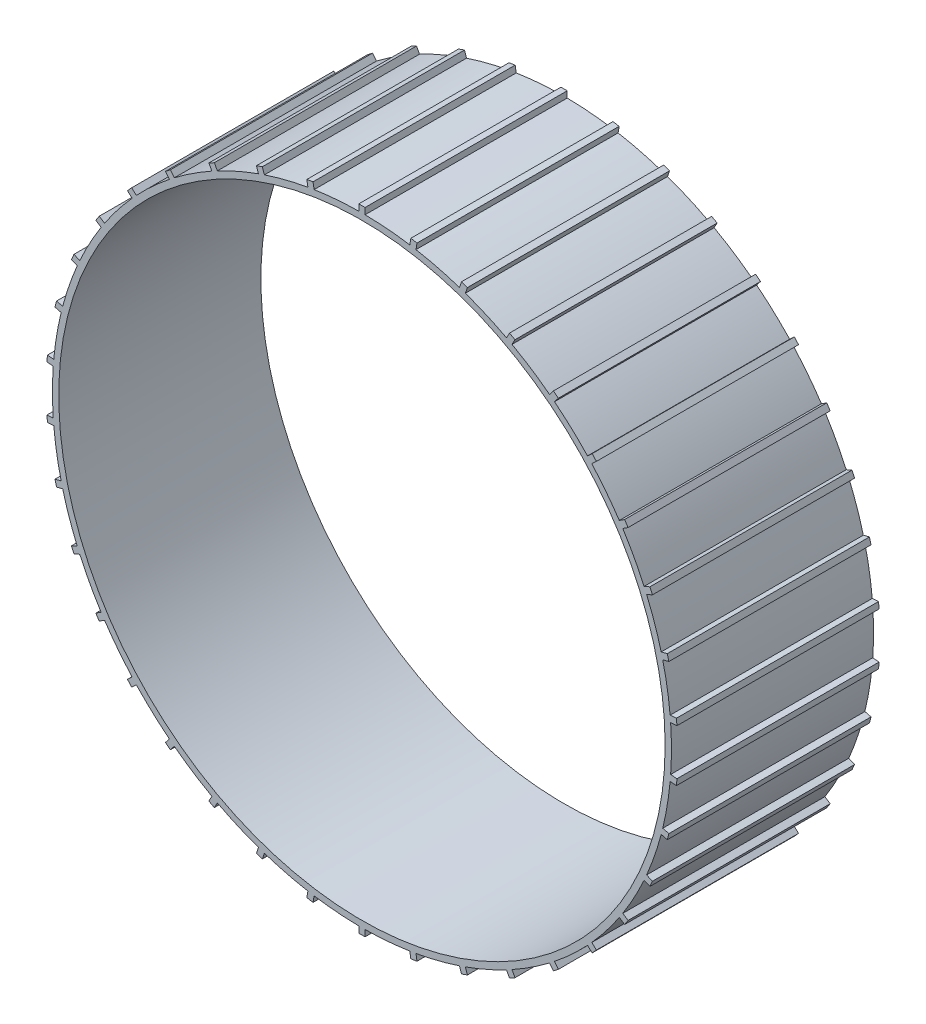
from build123d import *

# Parameters (mm, degrees)
SKETCH1_R           = 155.575
SKETCH1_R_2         = 152.4
BOSS_EXTRUDE1_DEPTH = 101.6
BOSS_EXTRUDE2_DEPTH = 101.6
CIRPATTERN1_COUNT   = 38


with BuildPart() as part:
    # Sketch1 → Boss-Extrude1 (new body)
    with BuildSketch(Plane.XY):
        Circle(SKETCH1_R)
        Circle(SKETCH1_R_2, mode=Mode.SUBTRACT)
    extrude(amount=BOSS_EXTRUDE1_DEPTH)

    # Sketch2 → Boss-Extrude2 (add, through all)
    with BuildSketch(Plane.XY.offset(101.6)):
        with BuildLine():
            Line((-1.5748, 158.75), (-1.5748, 155.567029379))
            ThreePointArc((-1.5748, 155.567029379), (0, 155.575), (1.5748, 155.567029379))
            Line((1.5748, 155.567029379), (1.5748, 158.75))
            Line((1.5748, 158.75), (-1.5748, 158.75))
        make_face()
    boss_extrude2 = extrude(amount=-BOSS_EXTRUDE2_DEPTH)

    # CirPattern1: Boss-Extrude2 ×38 about axis
    cirpattern1_axis = Axis((0, 0, 0), (0, 0, 1))
    for i in range(1, CIRPATTERN1_COUNT):
        add(boss_extrude2.rotate(cirpattern1_axis, i * 360 / CIRPATTERN1_COUNT))


solid = part.part
